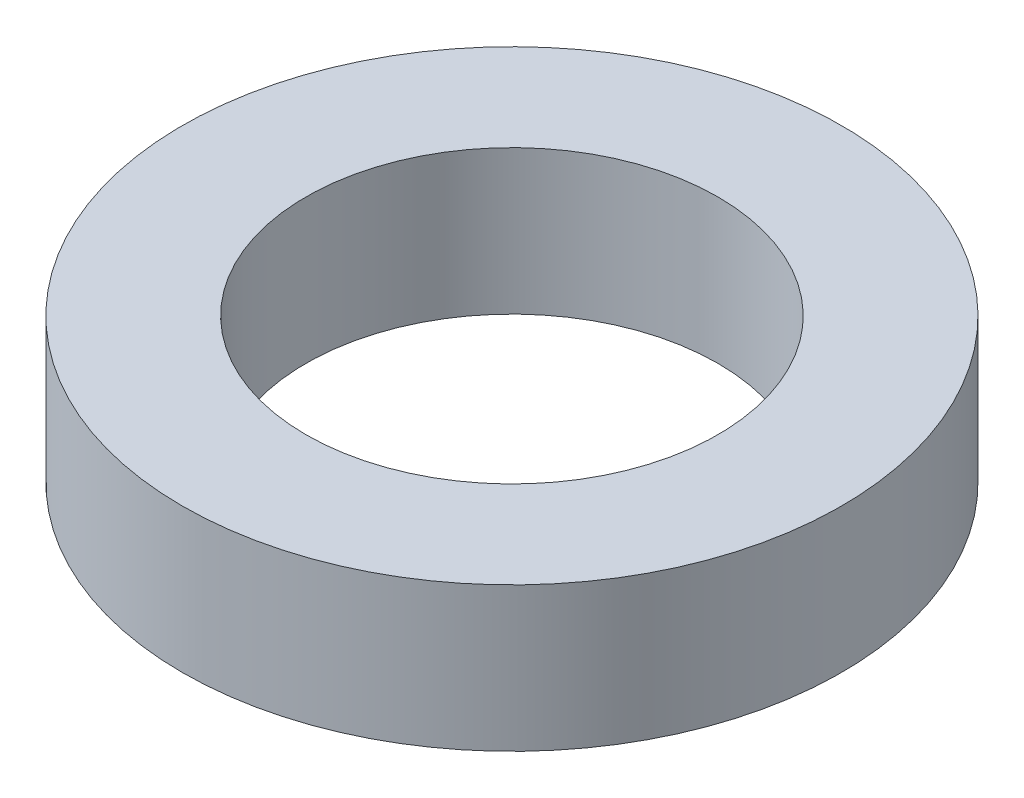
from build123d import *

# Parameters (mm, degrees)
SKETCH1_R           = 16
SKETCH1_R_2         = 10
BOSS_EXTRUDE1_DEPTH = 3.5


with BuildPart() as part:
    # Sketch1 → Boss-Extrude1 (new, symmetric)
    with BuildSketch(Plane(origin=(0, 0, 0), x_dir=(1, 0, 0), z_dir=(0, 1, 0))):
        with Locations(Location((0, 0, 0), (0, 0, 270))):
            Circle(SKETCH1_R)
        with Locations(Location((0, 0, 0), (0, 0, 270))):
            Circle(SKETCH1_R_2, mode=Mode.SUBTRACT)
    extrude(amount=BOSS_EXTRUDE1_DEPTH, both=True)


solid = part.part
